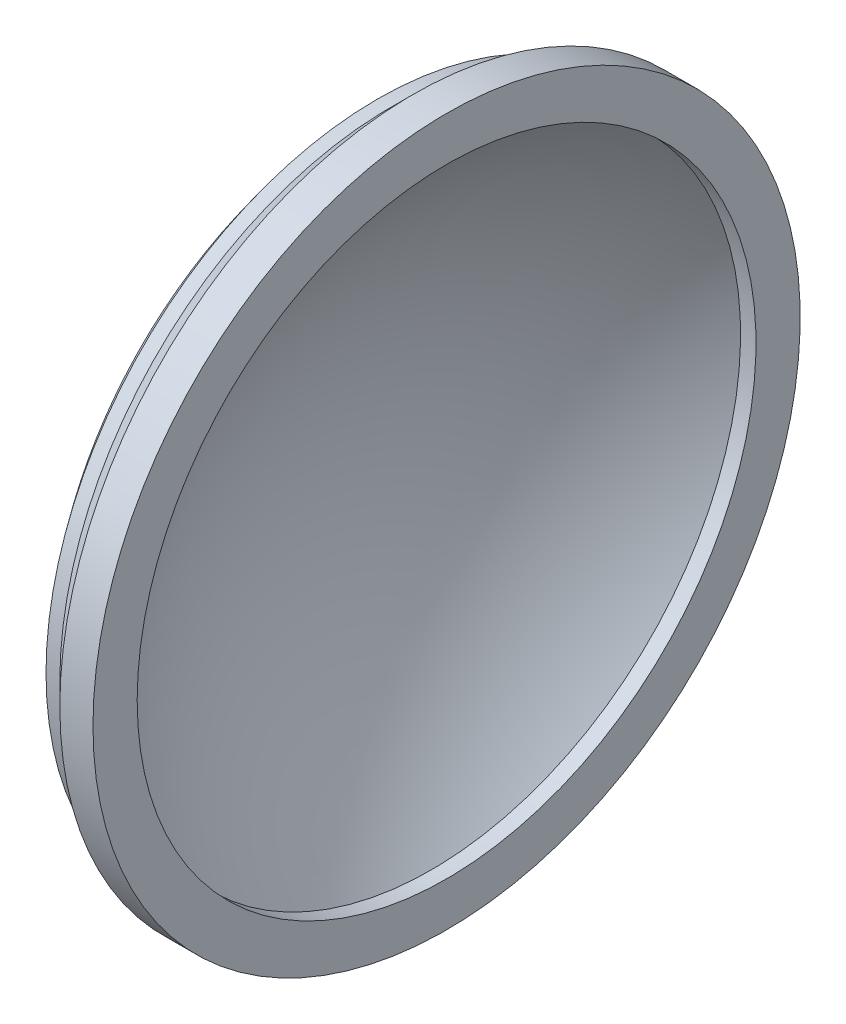
from build123d import *


with BuildPart() as part:
    # Sketch1 → Revolve1 (revolve)
    with BuildSketch(Plane.XY, mode=Mode.PRIVATE) as revolve1_sk:
        with BuildLine():
            Line((-28.5, 60), (-26, 60))
            Line((-26, 60), (-22, 64))
            Line((-22, 64), (-16, 64))
            Line((-16, 64), (-16, 56))
            Line((-16, 56), (-18.790689802, 56))
            ThreePointArc((-18.790689802, 56), (-34.407796248, 29.913629212), (-39.845400687, 0))
            Line((-39.845400687, 0), (-49.845400687, 0))
            ThreePointArc((-49.845400687, 0), (-44.350112671, 31.841899011), (-28.5, 60))
        make_face()
    revolve(revolve1_sk.sketch.rotate(Axis((-95.286618472, 0, 0), (1, 0, 0)), 90), axis=Axis((-95.286618472, 0, 0), (1, 0, 0)))


solid = part.part
